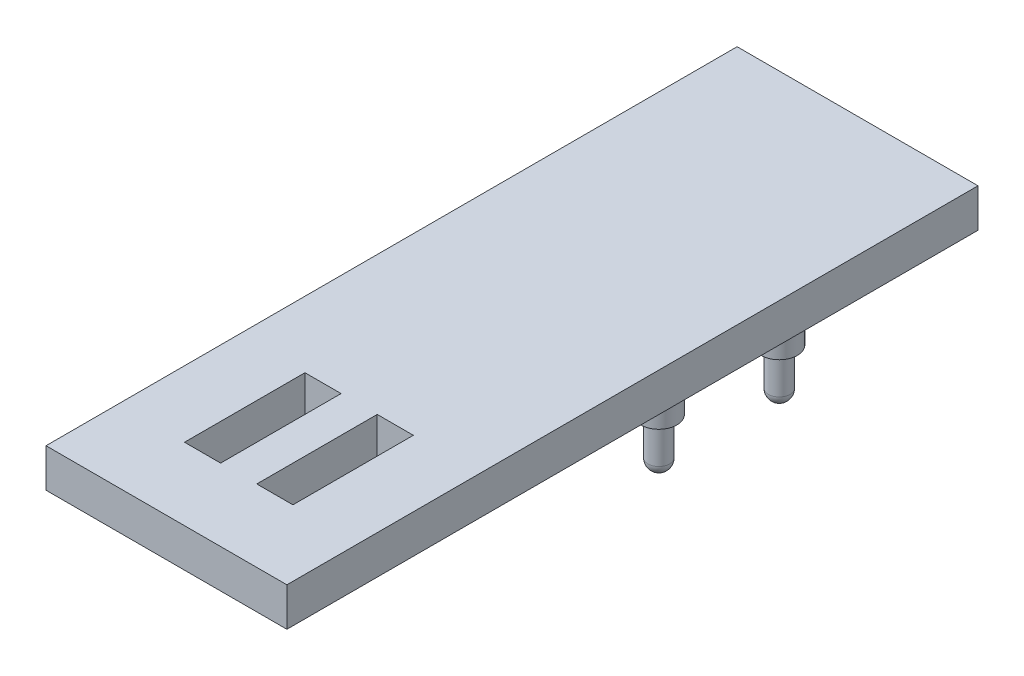
from build123d import *

# Parameters (mm, degrees)
SKETCH1_W           = 10
SKETCH1_H           = 31.69
SKETCH1_W_2         = 1.5
SKETCH1_H_2         = 5
BOSS_EXTRUDE1_DEPTH = 1.6
SKETCH4_R           = 1
BOSS_EXTRUDE2_DEPTH = 0.5
SKETCH5_R           = 0.75
BOSS_EXTRUDE3_DEPTH = 4.5
SKETCH6_R           = 0.45
BOSS_EXTRUDE4_DEPTH = 2
FILLET1_R           = 0.45
SKETCH7_W           = 10
SKETCH7_H           = 3
CUT_EXTRUDE1_DEPTH  = 10


with BuildPart() as part:
    # Sketch1 → Boss-Extrude1 (new body)
    with BuildSketch(Plane(origin=(0, 0, 0), x_dir=(1, 0, 0), z_dir=(0, 1, 0))):
        with Locations((0, -21.731751346)):
            Rectangle(SKETCH1_W, SKETCH1_H)
        with Locations((1.5, -29.076751346)):
            Rectangle(SKETCH1_W_2, SKETCH1_H_2, mode=Mode.SUBTRACT)
        with Locations((-1.5, -29.076751346)):
            Rectangle(SKETCH1_W_2, SKETCH1_H_2, mode=Mode.SUBTRACT)
    extrude(amount=BOSS_EXTRUDE1_DEPTH)

    # Sketch4 → Boss-Extrude2 (add)
    with BuildSketch(Plane.XZ):
        with Locations(Location((0, 9.136751346, 0), (0, 0, 90))):
            Circle(SKETCH4_R)
        with Locations(Location((0, 14.136751346, 0), (0, 0, 90))):
            Circle(SKETCH4_R)
    extrude(amount=BOSS_EXTRUDE2_DEPTH)

    # Sketch5 → Boss-Extrude3 (add)
    with BuildSketch(Plane.XZ.offset(0.5)):
        with Locations(Location((0, 9.136751346, 0), (0, 0, 270))):
            Circle(SKETCH5_R)
        with Locations(Location((0, 14.136751346, 0), (0, 0, 270))):
            Circle(SKETCH5_R)
    extrude(amount=BOSS_EXTRUDE3_DEPTH)

    # Sketch6 → Boss-Extrude4 (add)
    with BuildSketch(Plane.XZ.offset(5)):
        with Locations(Location((0, 9.136751346, 0), (0, 0, 270))):
            Circle(SKETCH6_R)
        with Locations(Location((0, 14.136751346, 0), (0, 0, 270))):
            Circle(SKETCH6_R)
    extrude(amount=BOSS_EXTRUDE4_DEPTH)

    # Fillet1
    fillet1_edges = [part.edges().sort_by_distance(p)[0] for p in [
        (0, -7, 9.586751346),
        (0, -7, 14.586751346),
    ]]
    fillet(fillet1_edges, radius=FILLET1_R)

    # Sketch7 → Cut-Extrude1 (cut)
    with BuildSketch(Plane.XZ):
        with Locations((0, 36.076751346)):
            Rectangle(SKETCH7_W, SKETCH7_H)
    extrude(amount=-CUT_EXTRUDE1_DEPTH, mode=Mode.SUBTRACT)


solid = part.part
